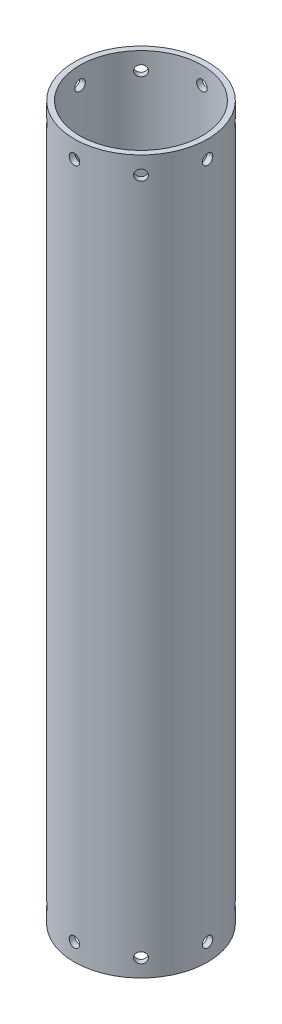
from build123d import *

# Parameters (mm, degrees)
ESBO_O1_R                  = 38.1
ESBO_O1_R_2                = 34.925
RESSALTO_EXTRUS_O1_DEPTH   = 407
CORTE_EXTRUS_O1_REACH      = 417.821
CORTE_EXTRUS_O1_END_RADIUS = 34.925
ESBO_O2_R                  = 3
PADR_OCIRCULAR1_COUNT      = 8


with BuildPart() as part:
    # Esboço1 → Ressalto-extrusão1 (new body)
    with BuildSketch(Plane(origin=(0, 0, 0), x_dir=(1, 0, 0), z_dir=(0, 1, 0))):
        with Locations(Location((0, 0, 0), (0, 0, 270))):
            Circle(ESBO_O1_R)
        with Locations(Location((0, 0, 0), (0, 0, 270))):
            Circle(ESBO_O1_R_2, mode=Mode.SUBTRACT)
    extrude(amount=RESSALTO_EXTRUS_O1_DEPTH)

    # Corte-extrusão1: up to this cylinder (the profile starts outside it)
    corte_extrus_o1_end = Plane(origin=(0, 203.5, 0), z_dir=(0, -1, 0)) * Cylinder(CORTE_EXTRUS_O1_END_RADIUS, 1293.492, mode=Mode.PRIVATE)
    # Esboço2 → Corte-extrusão1 (cut, up to the surface)
    with BuildSketch(Plane(origin=(38.1, 0, 0), x_dir=(0, 0, -1), z_dir=(1, 0, 0)), mode=Mode.PRIVATE) as corte_extrus_o1_sk1:
        with Locations((0, 397)):
            Circle(ESBO_O2_R)
    corte_extrus_o1_tool1 = extrude(corte_extrus_o1_sk1.sketch, amount=-CORTE_EXTRUS_O1_REACH, mode=Mode.PRIVATE) - corte_extrus_o1_end
    # Esboço2 → Corte-extrusão1 (cut, up to the surface)
    with BuildSketch(Plane(origin=(38.1, 0, 0), x_dir=(0, 0, -1), z_dir=(1, 0, 0)), mode=Mode.PRIVATE) as corte_extrus_o1_sk2:
        with Locations((0, 10)):
            Circle(ESBO_O2_R)
    corte_extrus_o1_tool2 = extrude(corte_extrus_o1_sk2.sketch, amount=-CORTE_EXTRUS_O1_REACH, mode=Mode.PRIVATE) - corte_extrus_o1_end
    corte_extrus_o1 = corte_extrus_o1_tool1.solids().sort_by_distance((38.1, 397, 0))[0] + corte_extrus_o1_tool2.solids().sort_by_distance((38.1, 10, 0))[0]
    add(corte_extrus_o1, mode=Mode.SUBTRACT)

    # PadrãoCircular1: Corte-extrusão1 ×8 about axis
    padr_ocircular1_axis = Axis((0, 407, 0), (0, 1, 0))
    for i in range(1, PADR_OCIRCULAR1_COUNT):
        add(corte_extrus_o1.rotate(padr_ocircular1_axis, i * 360 / PADR_OCIRCULAR1_COUNT), mode=Mode.SUBTRACT)


solid = part.part
